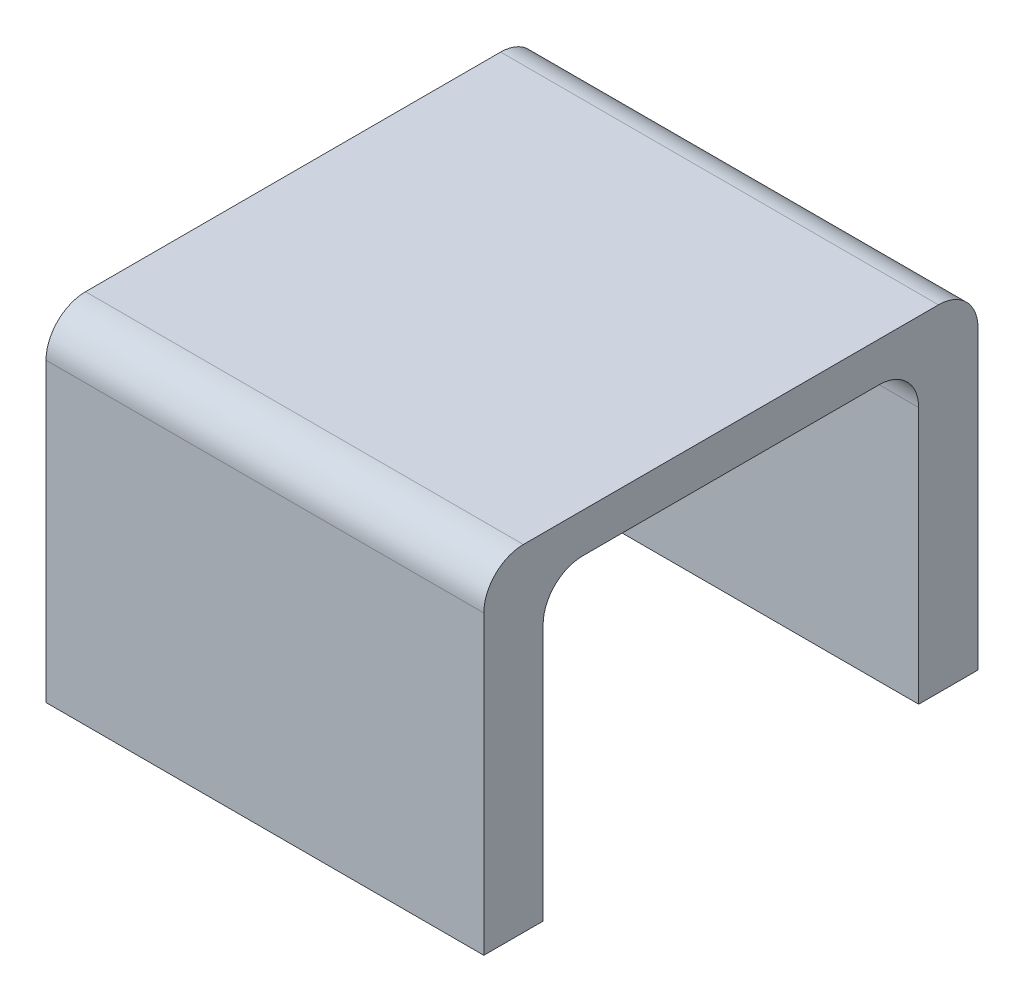
from build123d import *

# Parameters (mm, degrees)
ESQUISSE2_W             = 22.15
ESQUISSE2_H             = 25
BOSS_EXTRU_1_DEPTH      = 17
ESQUISSE3_W             = 22.15
ESQUISSE3_H             = 19
ENL_V_MAT_EXTRU_1_DEPTH = 15
CONG_1_R                = 2
CONG_2_R                = 2


with BuildPart() as part:
    # Esquisse2 → Boss.-Extru.1 (new body)
    with BuildSketch(Plane(origin=(0, 0, 0), x_dir=(1, 0, 0), z_dir=(0, 1, 0))):
        with Locations((17.241326531, 0.340136054)):
            Rectangle(ESQUISSE2_W, ESQUISSE2_H)
    extrude(amount=BOSS_EXTRU_1_DEPTH)

    # Esquisse3 → Enlèv. mat.-Extru.1 (cut)
    with BuildSketch(Plane.XZ):
        with Locations((17.241326531, -0.340136054)):
            Rectangle(ESQUISSE3_W, ESQUISSE3_H)
    extrude(amount=-ENL_V_MAT_EXTRU_1_DEPTH, mode=Mode.SUBTRACT)

    # Congé1
    cong_1_edges = [part.edges().sort_by_distance(p)[0] for p in [
        (17.241326531, 15, 9.159863946),
        (17.241326531, 15, -9.840136054),
    ]]
    fillet(cong_1_edges, radius=CONG_1_R)

    # Congé2
    cong_2_edges = [part.edges().sort_by_distance(p)[0] for p in [
        (17.241326531, 17, -12.840136054),
        (17.241326531, 17, 12.159863946),
    ]]
    fillet(cong_2_edges, radius=CONG_2_R)


solid = part.part
